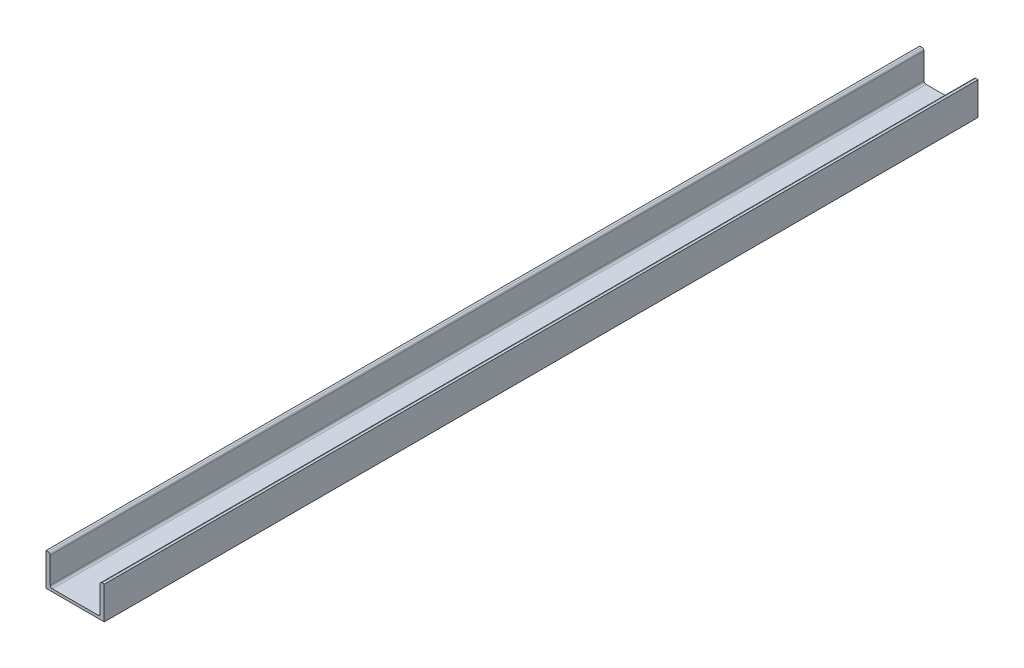
from build123d import *

# Parameters (mm, degrees)
BOSS_EXTRUDE1_DEPTH = 762
FILLET1_R           = 3.683


with BuildPart() as part:
    # Sketch3 → Boss-Extrude1 (new, symmetric)
    with BuildSketch(Plane.XY):
        Polygon((-50.8, 28.575), (-50.8, -28.575), (50.8, -28.575), (50.8, 28.575), (43.434, 28.575), (43.434, -23.749), (-43.434, -23.749), (-43.434, 28.575), align=None)
    extrude(amount=BOSS_EXTRUDE1_DEPTH, both=True)

    # Fillet1
    fillet1_edges = [part.edges().sort_by_distance(p)[0] for p in [
        (-43.434, 28.575, 0),
        (-43.434, -23.749, 0),
        (43.434, -23.749, 0),
        (43.434, 28.575, 0),
    ]]
    fillet(fillet1_edges, radius=FILLET1_R)


solid = part.part
